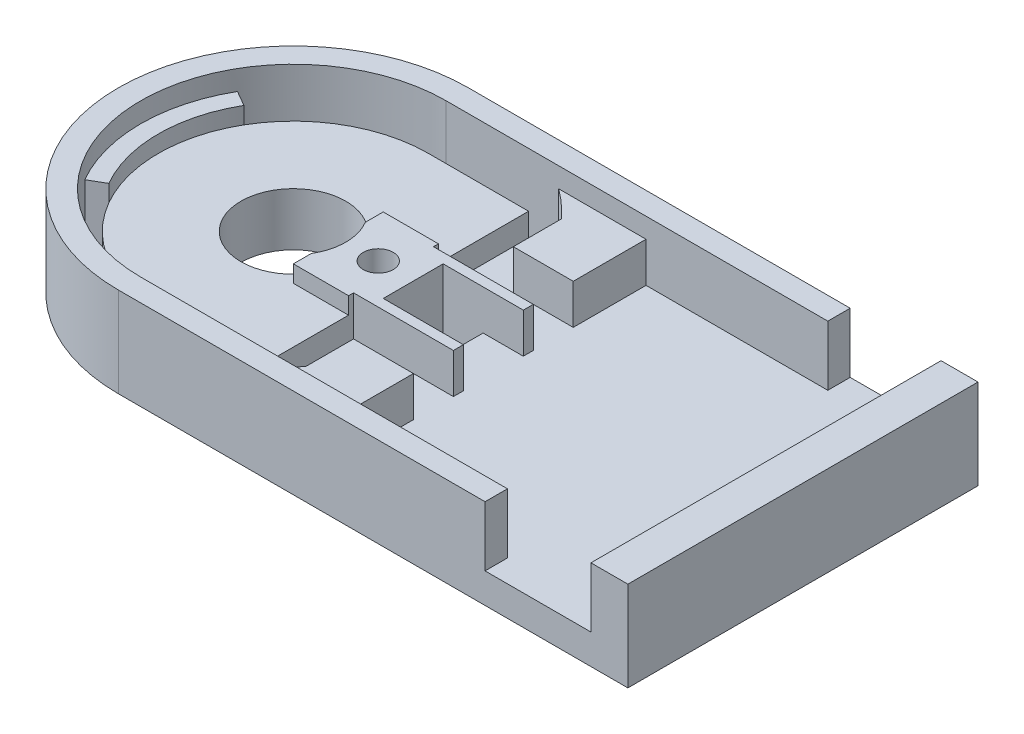
from build123d import *

# Parameters (mm, degrees)
SENSOR_BODY_BASE_DEPTH            = 9
CAMERA_HOLE_SKETCH_R              = 5.25
CAMERA_HOLE_DEPTH                 = 55.697637212
COVER_PLATE_CUTOUT_DEPTH          = 2
LED_DRIVER_CUTOUT_DEPTH           = 55.40433362
LED_DRIVER_CUTOUT_DEPTH_BACK      = 4
LEAD_START                        = 55.40433362
LEAD_CUTOUT_DEPTH                 = 62.40433362
FOLDED_LEAD_CUTOUT_DEPTH          = 4
GREEN_LEAD_CUTOUT_SKETCH_W        = 4
GREEN_LEAD_CUTOUT_SKETCH_H        = 6
GREEN_LEAD_CUTOUT_DEPTH           = 55.40433362
FOLDED_GREEN_LEAD_CUTOUT_SKETCH_W = 4.025
FOLDED_GREEN_LEAD_CUTOUT_SKETCH_H = 6
FOLDED_GREEN_LEAD_CUTOUT_DEPTH    = 4
CAMERA_PCB_CUTOUT_DEPTH           = 1.69
COVER_START                       = 1.69
COVER_PLATE_SUPPORT_DEPTH         = 1.69


with BuildPart() as part:
    # Sensor Body Base Sketch → Sensor Body Base (new body)
    with BuildSketch(Plane(origin=(0, 0, 0), x_dir=(1, 0, 0), z_dir=(0, 1, 0))):
        with BuildLine():
            Line((0, 17.5294293), (51.025, 17.5294293))
            Line((51.025, 17.5294293), (51.025, -17.5294293))
            Line((51.025, -17.5294293), (0, -17.5294293))
            ThreePointArc((0, -17.5294293), (-17.5294293, 0), (0, 17.5294293))
        make_face()
    extrude(amount=SENSOR_BODY_BASE_DEPTH)

    # Camera Hole Sketch → Camera Hole (cut, through all)
    with BuildSketch(Plane(origin=(0, 9, 0), x_dir=(1, 0, 0), z_dir=(0, 1, 0))):
        with Locations(Location((0, 0, 0), (0, 0, 270))):
            Circle(CAMERA_HOLE_SKETCH_R)
    extrude(amount=-CAMERA_HOLE_DEPTH, mode=Mode.SUBTRACT)

    # Cover Plate Cutout Sketch → Cover Plate Cutout (cut)
    # profile 1 of 2: a face of its own
    with BuildSketch(Plane(origin=(0, 9, 0), x_dir=(1, 0, 0), z_dir=(0, 1, 0))):
        with BuildLine():
            Line((47.325, 15.29), (0, 15.29))
            ThreePointArc((0, 15.29), (-15.29, 0), (0, -15.29))
            Line((0, -15.29), (47.325, -15.29))
            Line((47.325, -15.29), (47.325, -5.29))
            Line((47.325, -5.29), (47.325, 5.29))
            Line((47.325, 5.29), (47.325, 15.29))
        make_face()
        with BuildLine():
            ThreePointArc((4.308421985, -3), (-5.25, 0), (4.308421985, 3))
            Line((4.308421985, 3), (10.72655949, 3))
            Line((10.72655949, 3), (10.72655949, -3))
            Line((10.72655949, -3), (4.308421985, -3))
        make_face(mode=Mode.SUBTRACT)
    # profile 2 of 2: a face of its own
    with BuildSketch(Plane(origin=(0, 9, 0), x_dir=(1, 0, 0), z_dir=(0, 1, 0))):
        with BuildLine():
            Line((10.72655949, 3), (4.308421985, 3))
            ThreePointArc((4.308421985, 3), (5.009077531, 1.57214576), (5.25, 0))
            ThreePointArc((5.25, 0), (5.009077531, -1.57214576), (4.308421985, -3))
            Line((4.308421985, -3), (10.72655949, -3))
            Line((10.72655949, -3), (10.72655949, 3))
        make_face()
    extrude(amount=-COVER_PLATE_CUTOUT_DEPTH, mode=Mode.SUBTRACT)

    # LED Driver Cutout Sketch → LED Driver Cutout (cut, two sides: drawn at the far end of the back side and taken through both)
    with BuildSketch(Plane(origin=(0, 7, 0), x_dir=(1, 0, 0), z_dir=(0, 1, 0)).offset(-LED_DRIVER_CUTOUT_DEPTH_BACK)):
        Polygon((36.725, -17.5294293), (47.325, -17.5294293), (47.325, 17.5294293), (38.225, 17.5294293), (38.225, 15.29), (20.025, 15.29), (20.025, -15.29), (36.725, -15.29), align=None)
    extrude(amount=LED_DRIVER_CUTOUT_DEPTH + LED_DRIVER_CUTOUT_DEPTH_BACK, mode=Mode.SUBTRACT)

    # Cover Plate Fastener Sketch → Cover Plate Fastener (revolve, cut)
    with BuildSketch(Plane.XY, mode=Mode.PRIVATE) as cover_plate_fastener_sk:
        Polygon((8.5, 7), (8.5, 3.213974596), (10, 4.08), (10, 7), align=None)
    revolve(cover_plate_fastener_sk.sketch.rotate(Axis((8.5, 7, 0), (0, -1, 0)), 90), axis=Axis((8.5, 7, 0), (0, -1, 0)), mode=Mode.SUBTRACT)

    # Lead Cutout Shared Sketch → Lead Cutout (cut)
    with BuildSketch(Plane(origin=(0, 7, 0), x_dir=(1, 0, 0), z_dir=(0, 1, 0)).offset(LEAD_START)):
        with BuildLine():
            ThreePointArc((0, -13.5294293), (-6.76471465, -11.716829473), (-11.716829473, -6.76471465))
            Line((-11.716829473, -6.76471465), (-13.241528424, -7.645))
            ThreePointArc((-13.241528424, -7.645), (-7.645, -13.241528424), (0, -15.29))
            Line((0, -15.29), (11.279002615, -15.29))
            ThreePointArc((11.279002615, -15.29), (12.340917186, -14.446513871), (13.339960375, -13.5294293))
            Line((13.339960375, -13.5294293), (10.025, -13.5294293))
            Line((10.025, -13.5294293), (0, -13.5294293))
        make_face()
    lead_cutout = extrude(amount=-LEAD_CUTOUT_DEPTH, mode=Mode.SUBTRACT)

    # Sketch11<5> → Folded Lead Cutout (cut)
    with BuildSketch(Plane(origin=(0, 7, 0), x_dir=(1, 0, 0), z_dir=(0, 1, 0))):
        with BuildLine():
            Line((10.025, -4), (10.025, -13.5294293))
            Line((10.025, -13.5294293), (13.339960375, -13.5294293))
            ThreePointArc((13.339960375, -13.5294293), (13.687104196, -13.178132597), (14.025, -12.817931775))
            Line((14.025, -12.817931775), (14.025, -8))
            Line((14.025, -8), (20.025, -8))
            Line((20.025, -8), (20.025, -4))
            Line((20.025, -4), (10.025, -4))
        make_face()
    folded_lead_cutout = extrude(amount=-FOLDED_LEAD_CUTOUT_DEPTH, mode=Mode.SUBTRACT)

    # Lead Cutout Mirror: Lead Cutout, Folded Lead Cutout across plane
    add(lead_cutout.mirror(Plane.XY), mode=Mode.SUBTRACT)
    add(folded_lead_cutout.mirror(Plane.XY), mode=Mode.SUBTRACT)

    # Green Lead Cutout Sketch → Green Lead Cutout (cut, through all)
    with BuildSketch(Plane(origin=(0, 7, 0), x_dir=(1, 0, 0), z_dir=(0, 1, 0))):
        with Locations((14, 0)):
            Rectangle(GREEN_LEAD_CUTOUT_SKETCH_W, GREEN_LEAD_CUTOUT_SKETCH_H)
    extrude(amount=-GREEN_LEAD_CUTOUT_DEPTH, mode=Mode.SUBTRACT)

    # Folded Green Lead Cutout Sketch → Folded Green Lead Cutout (cut)
    with BuildSketch(Plane(origin=(0, 7, 0), x_dir=(1, 0, 0), z_dir=(0, 1, 0))):
        with Locations((18.0125, 0)):
            Rectangle(FOLDED_GREEN_LEAD_CUTOUT_SKETCH_W, FOLDED_GREEN_LEAD_CUTOUT_SKETCH_H)
    extrude(amount=-FOLDED_GREEN_LEAD_CUTOUT_DEPTH, mode=Mode.SUBTRACT)

    # Camera PCB Cutout Sketch → Camera PCB Cutout (cut)
    with BuildSketch(Plane(origin=(0, 7, 0), x_dir=(1, 0, 0), z_dir=(0, 1, 0))):
        with BuildLine():
            Line((-11.716829473, 6.76471465), (-13.241528424, 7.645))
            ThreePointArc((-13.241528424, 7.645), (-15.29, 0), (-13.241528424, -7.645))
            Line((-13.241528424, -7.645), (-11.716829473, -6.76471465))
            ThreePointArc((-11.716829473, -6.76471465), (-6.76471465, -11.716829473), (0, -13.5294293))
            Line((0, -13.5294293), (10.025, -13.5294293))
            Line((10.025, -13.5294293), (10.025, -4.5))
            Line((10.025, -4.5), (4.5, -4.5))
            Line((4.5, -4.5), (2.704163457, -4.5))
            ThreePointArc((2.704163457, -4.5), (0, -5.25), (-2.704163457, -4.5))
            Line((-2.704163457, -4.5), (-4.5, -4.5))
            Line((-4.5, -4.5), (-4.5, -2.704163457))
            ThreePointArc((-4.5, -2.704163457), (-5.25, 0), (-4.5, 2.704163457))
            Line((-4.5, 2.704163457), (-4.5, 4.5))
            Line((-4.5, 4.5), (-2.704163457, 4.5))
            ThreePointArc((-2.704163457, 4.5), (0, 5.25), (2.704163457, 4.5))
            Line((2.704163457, 4.5), (4.5, 4.5))
            Line((4.5, 4.5), (10.025, 4.5))
            Line((10.025, 4.5), (10.025, 13.5294293))
            Line((10.025, 13.5294293), (0, 13.5294293))
            ThreePointArc((0, 13.5294293), (-6.76471465, 11.716829473), (-11.716829473, 6.76471465))
        make_face()
        with BuildLine():
            Line((4.5, -4.5), (4.5, -2.704163457))
            ThreePointArc((4.5, -2.704163457), (3.712310601, -3.712310601), (2.704163457, -4.5))
            Line((2.704163457, -4.5), (4.5, -4.5))
        make_face()
        with BuildLine():
            ThreePointArc((-2.704163457, -4.5), (-3.712310601, -3.712310601), (-4.5, -2.704163457))
            Line((-4.5, -2.704163457), (-4.5, -4.5))
            Line((-4.5, -4.5), (-2.704163457, -4.5))
        make_face()
        with BuildLine():
            ThreePointArc((-4.5, 2.704163457), (-3.712310601, 3.712310601), (-2.704163457, 4.5))
            Line((-2.704163457, 4.5), (-4.5, 4.5))
            Line((-4.5, 4.5), (-4.5, 2.704163457))
        make_face()
        with BuildLine():
            Line((4.5, 2.704163457), (4.5, 4.5))
            Line((4.5, 4.5), (2.704163457, 4.5))
            ThreePointArc((2.704163457, 4.5), (3.712310601, 3.712310601), (4.5, 2.704163457))
        make_face()
    extrude(amount=-CAMERA_PCB_CUTOUT_DEPTH, mode=Mode.SUBTRACT)

    # Cover Plate Support Sketch → Cover Plate Support (add)
    with BuildSketch(Plane(origin=(0, 5.31, 0), x_dir=(1, 0, 0), z_dir=(0, 1, 0)).offset(COVER_START)):
        with BuildLine():
            Line((-11.716829473, 6.76471465), (-13.241528424, 7.645))
            ThreePointArc((-13.241528424, 7.645), (-15.29, 0), (-13.241528424, -7.645))
            Line((-13.241528424, -7.645), (-11.716829473, -6.76471465))
            ThreePointArc((-11.716829473, -6.76471465), (-13.5294293, 0), (-11.716829473, 6.76471465))
        make_face()
    extrude(amount=-COVER_PLATE_SUPPORT_DEPTH)


solid = part.part
